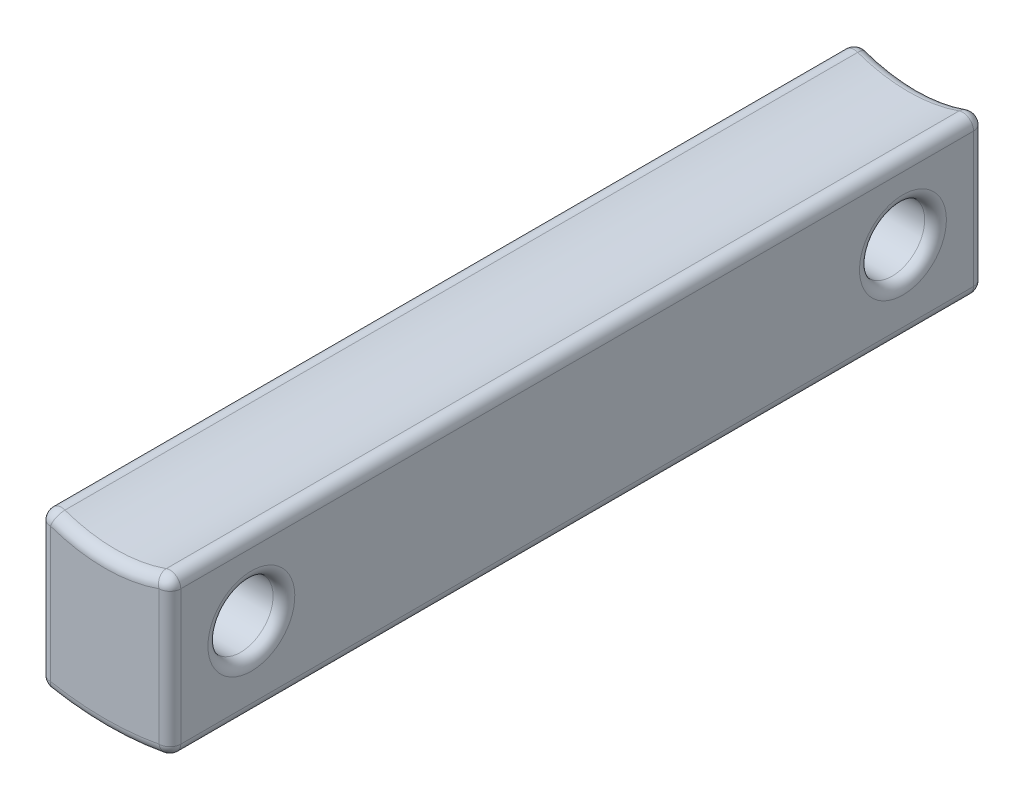
from build123d import *

# Parameters (mm, degrees)
EXTRUDE_1_DEPTH     = 37.5
SKETCH_2_R          = 3
CUT_EXTRUDE_1_DEPTH = 42.186918984
FILLET_1_R          = 1


with BuildPart() as part:
    # 草图1 → 凸台-拉伸1 (new, symmetric)
    with BuildSketch(Plane.XY):
        with BuildLine():
            Line((-13.74395899, 3.263197464), (-13.74395899, -11.437280558))
            ThreePointArc((-13.74395899, -11.437280558), (-7.74395899, -12.087691895), (-1.74395899, -11.437280558))
            Line((-1.74395899, -11.437280558), (-1.74395899, 3.263197464))
            ThreePointArc((-1.74395899, 3.263197464), (-7.74395899, 1.912308105), (-13.74395899, 3.263197464))
        make_face()
    extrude(amount=EXTRUDE_1_DEPTH, both=True)

    # 草图2 → 切除-拉伸1 (cut, through all)
    with BuildSketch(Plane.ZY.offset(13.74395899)):
        with Locations((30, -4.052061943)):
            Circle(SKETCH_2_R)
        with Locations((-30, -4.052061943)):
            Circle(SKETCH_2_R)
    extrude(amount=-CUT_EXTRUDE_1_DEPTH, mode=Mode.SUBTRACT)

    # 圆角1
    fillet_1_edges = [part.edges().sort_by_distance(p)[0] for p in [
        (-7.74395899, -12.087691895, 37.5),
        (-1.74395899, -4.087041547, 37.5),
        (-1.74395899, -4.052061943, 27),
        (-1.74395899, -4.052061943, -33),
        (-7.74395899, 1.912308105, 37.5),
        (-1.74395899, -4.087041547, -37.5),
        (-7.74395899, -12.087691895, -37.5),
        (-13.74395899, -4.087041547, -37.5),
        (-7.74395899, 1.912308105, -37.5),
        (-13.74395899, -4.087041547, 37.5),
        (-1.74395899, 3.263197464, 0),
        (-1.74395899, -11.437280558, 0),
        (-13.74395899, -11.437280558, 0),
        (-13.74395899, 3.263197464, 0),
    ]]
    fillet(fillet_1_edges, radius=FILLET_1_R)


solid = part.part
